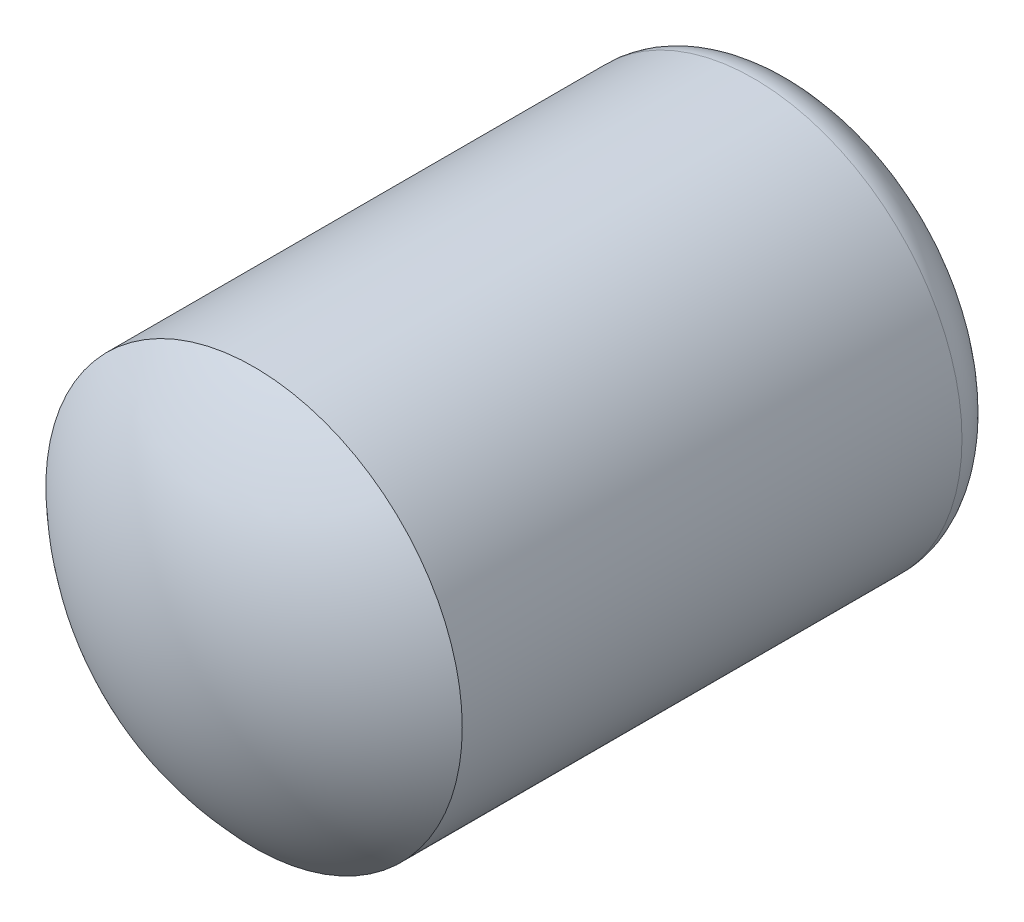
from build123d import *

# Parameters (mm, degrees)
BOSS_EXTRUDE1_DEPTH      = 2.54
BOSS_EXTRUDE1_DEPTH_BACK = 27.94
SKETCH1_R                = 12.7
DOME1_FACE_RADIUS        = 12.7
DOME1_HEIGHT             = 5.08
DOME2_FACE_RADIUS        = 12.7
DOME2_HEIGHT             = 5.08


with BuildPart() as part:
    # Sketch1 → Boss-Extrude1 (new, two sides: drawn at the far end of the back side and taken through both)
    with BuildSketch(Plane.XY.offset(-BOSS_EXTRUDE1_DEPTH_BACK)):
        with Locations((114.42340137, 123.880750733)):
            Circle(SKETCH1_R)
    extrude(amount=BOSS_EXTRUDE1_DEPTH + BOSS_EXTRUDE1_DEPTH_BACK)

    # Dome1: an elliptical dome of height H over a round flat face of radius A is half a spheroid: the quarter ellipse of half axes A and H revolved about the face's axis
    with BuildSketch(Plane((114.42340137, 123.880750733, -27.94), x_dir=(0, -1, 0), z_dir=(1, 0, 0)), mode=Mode.PRIVATE) as dome1_quarter:
        Ellipse(DOME1_FACE_RADIUS, DOME1_HEIGHT)
        Rectangle(DOME1_FACE_RADIUS, DOME1_HEIGHT, align=(Align.MIN, Align.MIN), mode=Mode.INTERSECT)
    revolve(dome1_quarter.sketch, axis=Axis((114.42340137, 123.880750733, -27.94), (0, 0, -1)))

    # Dome2: a dome of height H over a round flat face of radius A is a cap of a sphere of radius (A * A + H * H) / (2 * H)
    dome2_r = (DOME2_FACE_RADIUS * DOME2_FACE_RADIUS + DOME2_HEIGHT * DOME2_HEIGHT) / (2 * DOME2_HEIGHT)
    dome2_base = Plane((114.42340137, 123.880750733, 2.54), z_dir=(0, 0, 1))
    with Locations(dome2_base.offset(DOME2_HEIGHT - dome2_r)):
        dome2_ball = Sphere(dome2_r, mode=Mode.PRIVATE)
    add(split(dome2_ball, bisect_by=dome2_base, keep=Keep.TOP, mode=Mode.PRIVATE))


solid = part.part
